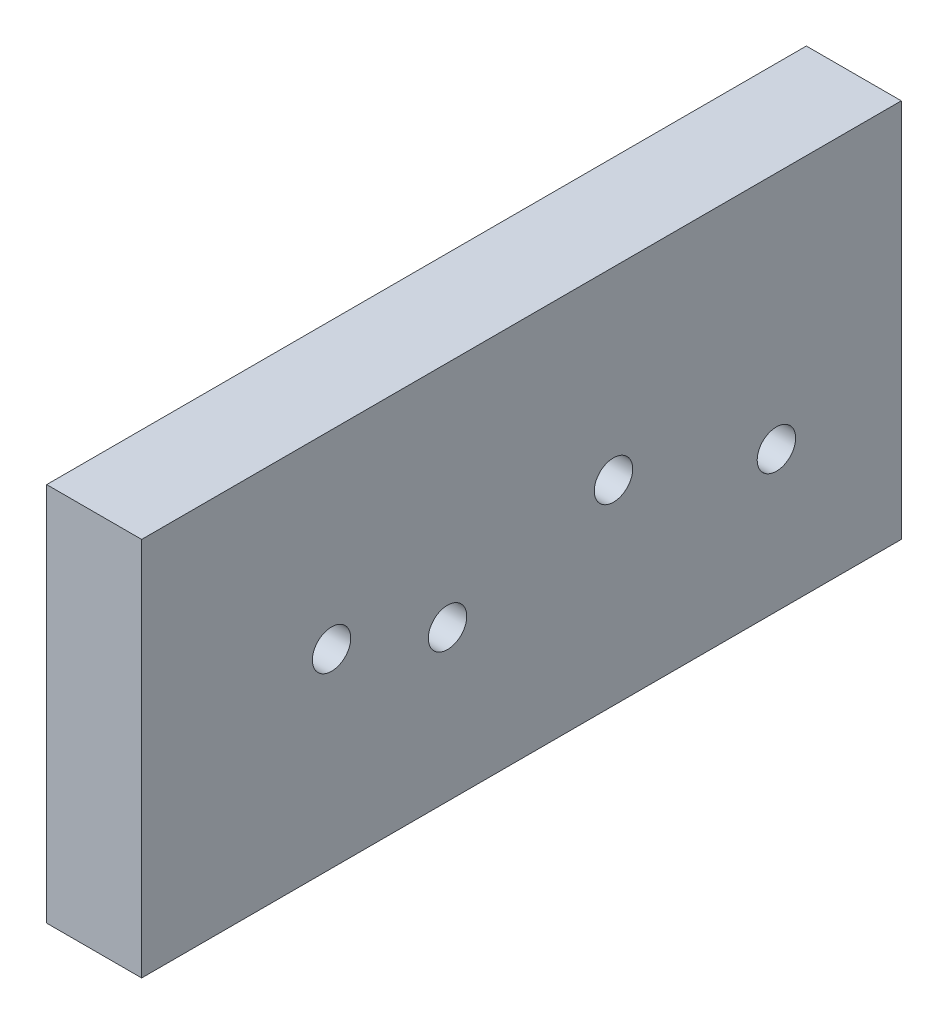
from build123d import *

# Parameters (mm, degrees)
SKETCH1_R                       = 3.854557775
BOSS_EXTRUDE1_DEPTH             = 19.05
F_1_4_0_25_DIAMETER_HOLE2_D     = 6.35
F_1_4_0_25_DIAMETER_HOLE2_DEPTH = 12.7
F_1_4_0_25_DIAMETER_HOLE2_TIP   = 1.907732465
SKETCH2_R                       = 4.7625
CUT_EXTRUDE1_DEPTH              = 6.35


with BuildPart() as part:
    # Sketch1 → Boss-Extrude1 (new body)
    # profile 1 of 2: a face of its own
    with BuildSketch(Plane(origin=(0, 0, 0), x_dir=(0, 0, -1), z_dir=(1, 0, 0))):
        with BuildLine():
            Line((-76.2, 38.1), (-76.2, 0))
            Line((-76.2, 0), (-41.954557775, 0))
            ThreePointArc((-41.954557775, 0), (-38.1, 3.854557775), (-34.245442225, 0))
            Line((-34.245442225, 0), (14.762299925, 0))
            ThreePointArc((14.762299925, 0), (17.903949731, 4.910646748), (22.312291357, 1.096077429))
            ThreePointArc((22.312291357, 1.096077429), (22.272302901, 0.542293578), (22.153167239, 0))
            Line((22.153167239, 0), (76.2, 0))
            Line((76.2, 0), (76.2, 38.1))
            Line((76.2, 38.1), (-76.2, 38.1))
        make_face()
    # profile 2 of 2: a face of its own
    with BuildSketch(Plane(origin=(0, 0, 0), x_dir=(0, 0, -1), z_dir=(1, 0, 0))):
        with BuildLine():
            Line((-41.954557775, 0), (-76.2, 0))
            Line((-76.2, 0), (-76.2, -38.1))
            Line((-76.2, -38.1), (76.2, -38.1))
            Line((76.2, -38.1), (76.2, 0))
            Line((76.2, 0), (22.153167239, 0))
            ThreePointArc((22.153167239, 0), (18.457733582, -2.758480346), (14.762299925, 0))
            Line((14.762299925, 0), (-34.245442225, 0))
            ThreePointArc((-34.245442225, 0), (-38.1, -3.854557775), (-41.954557775, 0))
        make_face()
        with Locations((-14.836022013, -7.860160654)):
            Circle(SKETCH1_R, mode=Mode.SUBTRACT)
        with Locations((51.143457994, -9.873506971)):
            Circle(SKETCH1_R, mode=Mode.SUBTRACT)
    extrude(amount=BOSS_EXTRUDE1_DEPTH)

    # 1/4 (0.25) Diameter Hole2
    with Locations(Plane.XZ.offset(38.1)):
        with Locations((9.525, 57.15), (9.525, -63.5), (9.525, 0)):
            Hole(F_1_4_0_25_DIAMETER_HOLE2_D / 2, depth=F_1_4_0_25_DIAMETER_HOLE2_DEPTH)
            with Locations((0, 0, -(F_1_4_0_25_DIAMETER_HOLE2_DEPTH + F_1_4_0_25_DIAMETER_HOLE2_TIP / 2))):  # 118° drill point
                Cone(0, F_1_4_0_25_DIAMETER_HOLE2_D / 2, F_1_4_0_25_DIAMETER_HOLE2_TIP, mode=Mode.SUBTRACT)

    # Sketch2 → Cut-Extrude1 (cut)
    with BuildSketch(Plane.ZY):
        with Locations((38.1, 0)):
            Circle(SKETCH2_R)
        with Locations((14.836022013, -7.860160654)):
            Circle(SKETCH2_R)
        with Locations((-18.457733582, 1.096077429)):
            Circle(SKETCH2_R)
        with Locations((-51.143457994, -9.873506971)):
            Circle(SKETCH2_R)
    extrude(amount=-CUT_EXTRUDE1_DEPTH, mode=Mode.SUBTRACT)


solid = part.part
